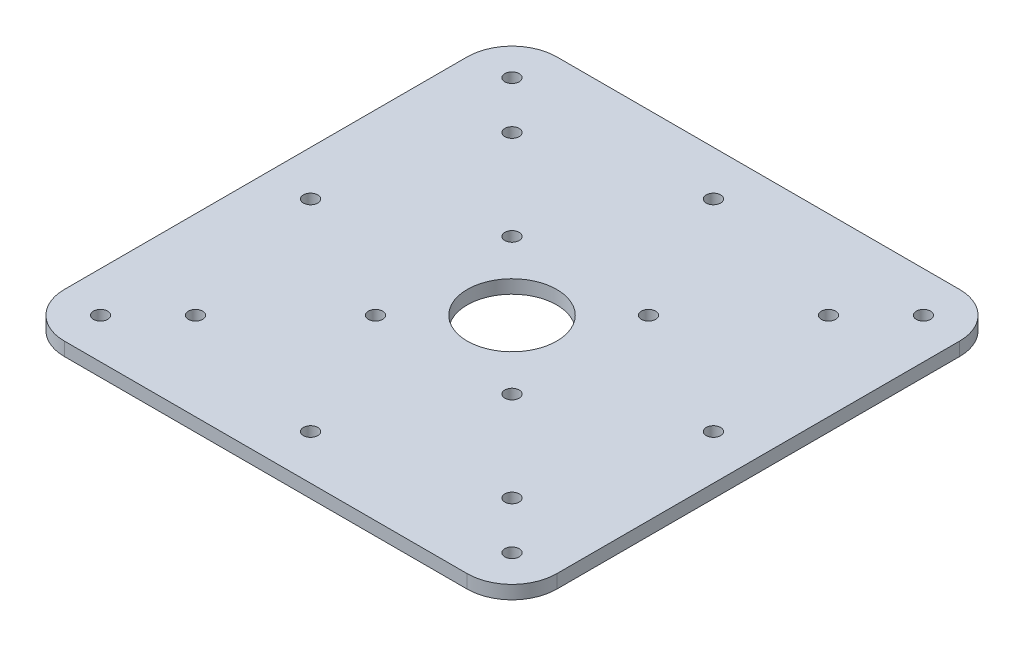
from build123d import *

# Parameters (mm, degrees)
SKETCH2_W           = 110
SKETCH2_H           = 110
SKETCH2_R           = 1.6
SKETCH2_R_2         = 10
BOSS_EXTRUDE1_DEPTH = 3
FILLET1_R           = 10


with BuildPart() as part:
    # Sketch2 → Boss-Extrude1 (new body)
    with BuildSketch(Plane(origin=(0, 0, 0), x_dir=(1, 0, 0), z_dir=(0, 1, 0))):
        Rectangle(SKETCH2_W, SKETCH2_H)
        with Locations(Location((15.25, 15.25, 0), (0, 0, 270))):
            Circle(SKETCH2_R, mode=Mode.SUBTRACT)
        with Locations(Location((-15.25, 15.25, 0), (0, 0, 90))):
            Circle(SKETCH2_R, mode=Mode.SUBTRACT)
        with Locations(Location((-15.25, -15.25, 0), (0, 0, 270))):
            Circle(SKETCH2_R, mode=Mode.SUBTRACT)
        with Locations(Location((15.25, -15.25, 0), (0, 0, 90))):
            Circle(SKETCH2_R, mode=Mode.SUBTRACT)
        with Locations(Location((35.3553, 35.3553, 0), (0, 0, 270))):
            Circle(SKETCH2_R, mode=Mode.SUBTRACT)
        with Locations(Location((45.9619, 45.9619, 0), (0, 0, 270))):
            Circle(SKETCH2_R, mode=Mode.SUBTRACT)
        with Locations(Location((-35.3553, 35.3553, 0), (0, 0, 90))):
            Circle(SKETCH2_R, mode=Mode.SUBTRACT)
        with Locations(Location((-45.9619, 45.9619, 0), (0, 0, 90))):
            Circle(SKETCH2_R, mode=Mode.SUBTRACT)
        with Locations(Location((45.9619, -45.9619, 0), (0, 0, 90))):
            Circle(SKETCH2_R, mode=Mode.SUBTRACT)
        with Locations(Location((35.3553, -35.3553, 0), (0, 0, 90))):
            Circle(SKETCH2_R, mode=Mode.SUBTRACT)
        with Locations(Location((-45.9619, -45.9619, 0), (0, 0, 270))):
            Circle(SKETCH2_R, mode=Mode.SUBTRACT)
        with Locations(Location((-35.3553, -35.3553, 0), (0, 0, 270))):
            Circle(SKETCH2_R, mode=Mode.SUBTRACT)
        with Locations(Location((0, 45, 0), (0, 0, 270))):
            Circle(SKETCH2_R, mode=Mode.SUBTRACT)
        with Locations(Location((0, -45, 0), (0, 0, 270))):
            Circle(SKETCH2_R, mode=Mode.SUBTRACT)
        with Locations(Location((45, 0, 0), (0, 0, 270))):
            Circle(SKETCH2_R, mode=Mode.SUBTRACT)
        with Locations(Location((-45, 0, 0), (0, 0, 270))):
            Circle(SKETCH2_R, mode=Mode.SUBTRACT)
        with Locations(Location((0, 0, 0), (0, 0, 270))):
            Circle(SKETCH2_R_2, mode=Mode.SUBTRACT)
    extrude(amount=BOSS_EXTRUDE1_DEPTH)

    # Fillet1
    fillet1_edges = [part.edges().sort_by_distance(p)[0] for p in [
        (55, 1.5, 55),
        (-55, 1.5, 55),
        (-55, 1.5, -55),
        (55, 1.5, -55),
    ]]
    fillet(fillet1_edges, radius=FILLET1_R)


solid = part.part
